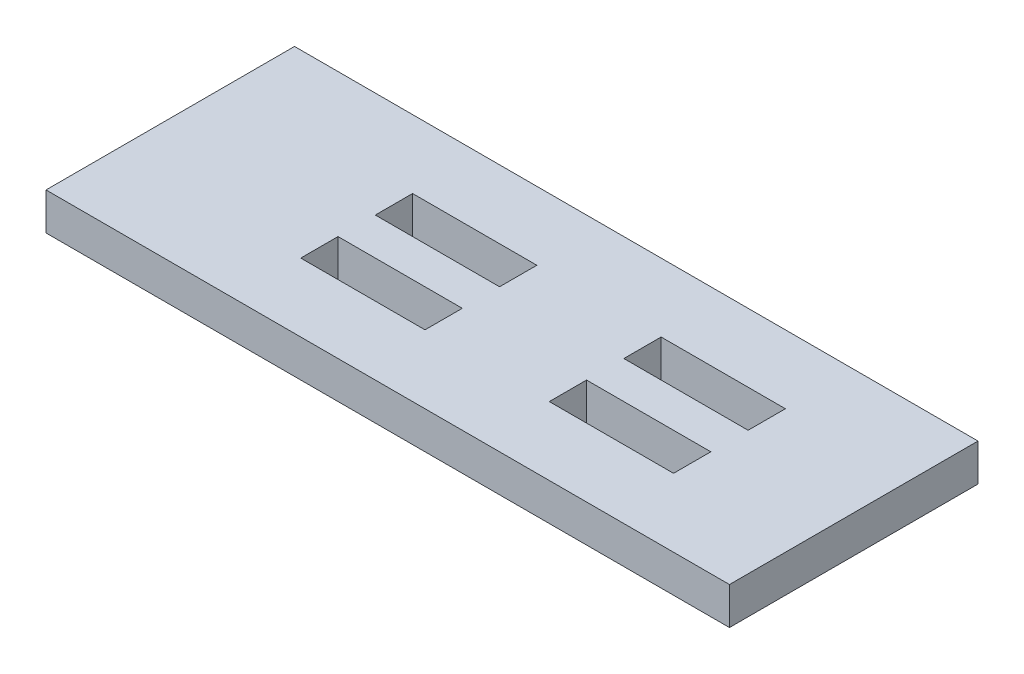
from build123d import *

# Parameters (mm, degrees)
SKETCH1_W           = 55
SKETCH1_H           = 20
BOSS_EXTRUDE1_DEPTH = 3
SKETCH2_W           = 10
SKETCH2_H           = 3
CUT_EXTRUDE1_DEPTH  = 3


with BuildPart() as part:
    # Sketch1 → Boss-Extrude1 (new body)
    with BuildSketch(Plane(origin=(0, 0, 0), x_dir=(1, 0, 0), z_dir=(0, 1, 0))):
        with Locations((-27.5, 10)):
            Rectangle(SKETCH1_W, SKETCH1_H)
    extrude(amount=BOSS_EXTRUDE1_DEPTH)

    # Sketch2 → Cut-Extrude1 (cut)
    with BuildSketch(Plane(origin=(0, 3, 0), x_dir=(1, 0, 0), z_dir=(0, 1, 0))):
        with Locations((-15, 13)):
            Rectangle(SKETCH2_W, SKETCH2_H)
        with Locations((-35, 13)):
            Rectangle(SKETCH2_W, SKETCH2_H)
        with Locations((-15, 7)):
            Rectangle(SKETCH2_W, SKETCH2_H)
        with Locations((-35, 7)):
            Rectangle(SKETCH2_W, SKETCH2_H)
    extrude(amount=-CUT_EXTRUDE1_DEPTH, mode=Mode.SUBTRACT)


solid = part.part
